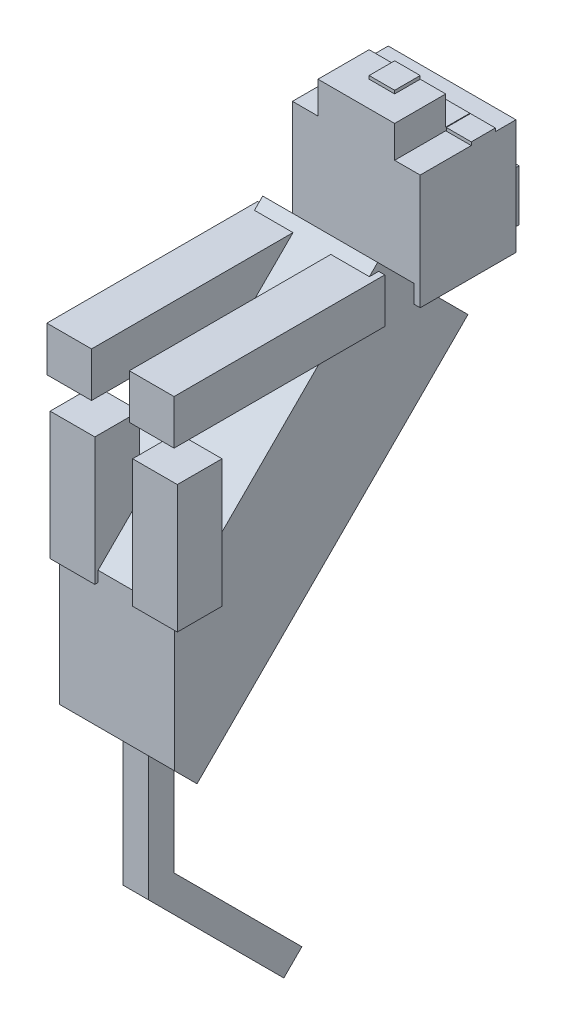
from build123d import *

# Parameters (mm, degrees)
SKETCH1_W                = 20
SKETCH1_H                = 15
BOSS_EXTRUDE1_DEPTH      = 18
SKETCH2_W                = 12
SKETCH2_H                = 8
BOSS_EXTRUDE2_DEPTH      = 5
SKETCH4_W                = 4
SKETCH4_H                = 4
BOSS_EXTRUDE4_DEPTH      = 0.5
SKETCH3_W                = 3.5
SKETCH3_H                = 8
BOSS_EXTRUDE3_DEPTH      = 4
SKETCH5_W                = 4.004840827
SKETCH5_H                = 3.775181513
SKETCH5_W_2              = 3.995159173
SKETCH5_W_3              = 3.9
BOSS_EXTRUDE5_DEPTH      = 0.5
BOSS_EXTRUDE6_DEPTH      = 2
BOSS_EXTRUDE6_DEPTH_BACK = 43
SKETCH7_W                = 18
SKETCH7_H                = 20
FRONT_START              = 13
SKETCH8_W                = 7
SKETCH8_H                = 7
FRONT_PAWS_DEPTH         = 33
BOSS_EXTRUDE8_DEPTH      = 18
BOSS_EXTRUDE9_START      = -5
SKETCH10_W               = 7
SKETCH10_H               = 7
BOSS_EXTRUDE9_DEPTH      = 20
CHAMFER1_SIZE            = 5
CHAMFER1_SIZE2           = 7.071067812
BOSS_EXTRUDE10_START     = -37
SKETCH11_W               = 4
SKETCH11_H               = 4
BOSS_EXTRUDE10_DEPTH     = 30
SKETCH13_W               = 4
SKETCH13_H               = 4
BOSS_EXTRUDE11_DEPTH     = 30


with BuildPart() as part:
    # Sketch1 → Boss-Extrude1 (new body)
    with BuildSketch(Plane(origin=(0, 0, 0), x_dir=(1, 0, 0), z_dir=(0, 1, 0))):
        Rectangle(SKETCH1_W, SKETCH1_H)
    extrude(amount=BOSS_EXTRUDE1_DEPTH)

    # Sketch2 → Boss-Extrude2 (add)
    with BuildSketch(Plane(origin=(0, 18, 0), x_dir=(1, 0, 0), z_dir=(0, 1, 0))):
        with Locations((0, -3.5)):
            Rectangle(SKETCH2_W, SKETCH2_H)
    extrude(amount=BOSS_EXTRUDE2_DEPTH)

    # Sketch4 → Boss-Extrude4 (add)
    with BuildSketch(Plane(origin=(0, 23, 0), x_dir=(1, 0, 0), z_dir=(0, 1, 0))):
        with Locations((0.004840827, -1.5)):
            Rectangle(SKETCH4_W, SKETCH4_H)
    extrude(amount=BOSS_EXTRUDE4_DEPTH)

    # Sketch3 → Boss-Extrude3 (add)
    with BuildSketch(Plane(origin=(0, 0, -7.5), x_dir=(-1, 0, 0), z_dir=(0, 0, -1))):
        with Locations((-4.75, 4)):
            Rectangle(SKETCH3_W, SKETCH3_H)
        with Locations((4.75, 4)):
            Rectangle(SKETCH3_W, SKETCH3_H)
    extrude(amount=BOSS_EXTRUDE3_DEPTH)

    # Sketch5 → Boss-Extrude5 (add)
    with BuildSketch(Plane(origin=(0, 18, 0), x_dir=(1, 0, 0), z_dir=(0, 1, 0))):
        with Locations((-3.997579587, 2.387590757)):
            Rectangle(SKETCH5_W, SKETCH5_H)
        with Locations((4.002420414, 2.387590757)):
            Rectangle(SKETCH5_W_2, SKETCH5_H)
        with Locations((-8.05, 2.387590757)):
            Rectangle(SKETCH5_W_3, SKETCH5_H)
        with Locations((8.05, 2.387590757)):
            Rectangle(SKETCH5_W_3, SKETCH5_H)
    extrude(amount=BOSS_EXTRUDE5_DEPTH)

    # Sketch7 → Boss-Extrude6 (add, two sides: drawn at the far end of the back side and taken through both)
    with BuildSketch(Plane(origin=(0, -3.75, 3.75), x_dir=(1, 0, 0), z_dir=(0, 0.7071067811865488, -0.7071067811865464)).offset(-BOSS_EXTRUDE6_DEPTH_BACK)):
        with Locations((0, -5.303300859)):
            Rectangle(SKETCH7_W, SKETCH7_H)
    extrude(amount=BOSS_EXTRUDE6_DEPTH + BOSS_EXTRUDE6_DEPTH_BACK)

    # Sketch8 → front paws (add)
    with BuildSketch(Plane.XY.offset(FRONT_START)):
        with Locations((-6.458894343, 3.691922456)):
            Rectangle(SKETCH8_W, SKETCH8_H)
        with Locations((6.458894343, 3.691922456)):
            Rectangle(SKETCH8_W, SKETCH8_H)
    extrude(amount=FRONT_PAWS_DEPTH)

    # Sketch9 → Boss-Extrude8 (add)
    with BuildSketch(Plane(origin=(9, 0, 0), x_dir=(0, 0, -1), z_dir=(1, 0, 0))):
        Polygon((-44.976659403, -23.334523779), (-30.834523779, -37.476659403), (-44.976659403, -51.618795027), align=None)
    extrude(amount=-BOSS_EXTRUDE8_DEPTH)

    # Sketch10 → Boss-Extrude9 (add)
    with BuildSketch(Plane(origin=(0, 0, 0), x_dir=(1, 0, 0), z_dir=(0, 1, 0)).offset(BOSS_EXTRUDE9_START)):
        with Locations((-6.458894343, -41.986772092)):
            Rectangle(SKETCH10_W, SKETCH10_H)
        with Locations((6.458894343, -41.986772092)):
            Rectangle(SKETCH10_W, SKETCH10_H)
    extrude(amount=-BOSS_EXTRUDE9_DEPTH)

    # Chamfer1
    chamfer1_edges = [part.edges().sort_by_distance(p)[0] for p in [
        (0, -51.618795027, 44.976659403),
    ]]
    chamfer1_side = [part.faces().sort_by_distance(p)[0] for p in [
        (0, -28.637824638, 21.995689014),
    ]]
    chamfer(chamfer1_edges, length=CHAMFER1_SIZE, length2=CHAMFER1_SIZE2, reference=chamfer1_side[0])

    # Sketch11 → Boss-Extrude10 (add)
    with BuildSketch(Plane(origin=(0, 0, 0), x_dir=(1, 0, 0), z_dir=(0, 1, 0)).offset(BOSS_EXTRUDE10_START)):
        with Locations((0, -40.063214372)):
            Rectangle(SKETCH11_W, SKETCH11_H)
    extrude(amount=-BOSS_EXTRUDE10_DEPTH)

    # Sketch13 → Boss-Extrude11 (add)
    with BuildSketch(Plane(origin=(0, -12.468392814, -12.468392814), x_dir=(-1, 0, 0), z_dir=(0, -0.7071067811865465, -0.7071067811865487))):
        with Locations((0, -75.119338461)):
            Rectangle(SKETCH13_W, SKETCH13_H)
    extrude(amount=BOSS_EXTRUDE11_DEPTH)


solid = part.part
